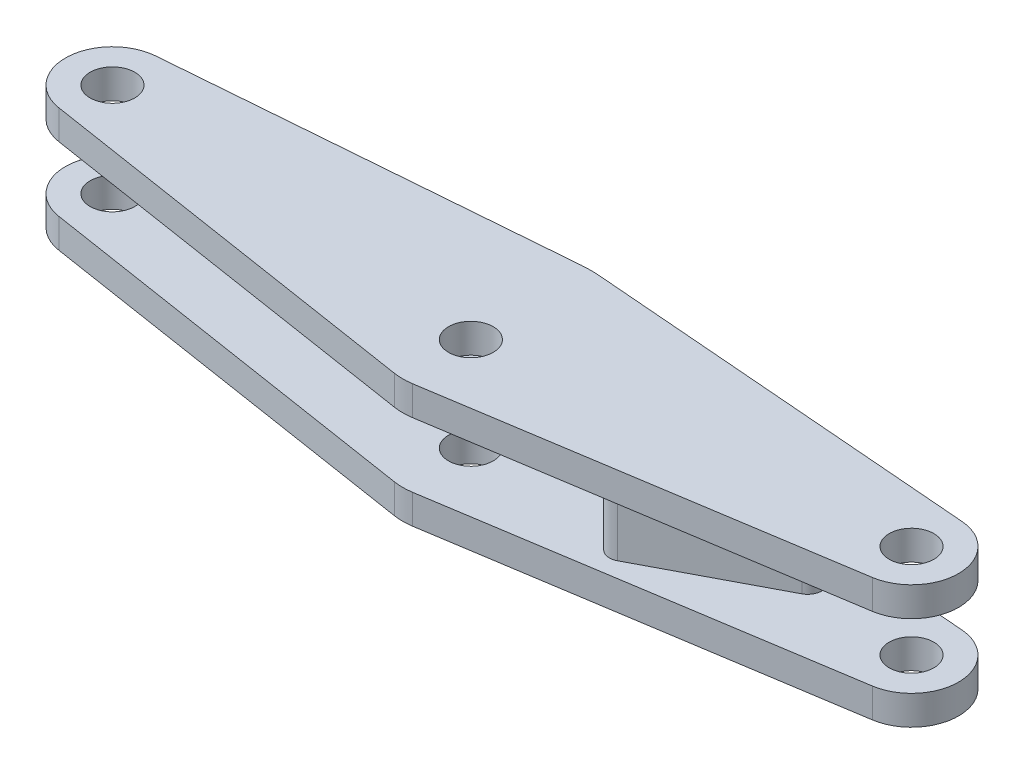
from build123d import *

# Parameters (mm, degrees)
SKETCH1_R                = 0.95
BOSS_EXTRUDE1_DEPTH      = 2.625
CUT_EXTRUDE1_DEPTH       = 20.736086872
CUT_EXTRUDE1_DEPTH_BACK  = 20.736086872
SKETCH3_W                = 38
SKETCH3_H                = 2.75
BOSS_EXTRUDE2_DEPTH      = 2.625
BOSS_EXTRUDE2_DEPTH_BACK = 1.375


with BuildPart() as part:
    # Sketch1 → Boss-Extrude1 (new, symmetric)
    with BuildSketch(Plane(origin=(0, 0, 0), x_dir=(1, 0, 0), z_dir=(0, 1, 0))):
        with BuildLine():
            Line((-17.159441359, 1.993634483), (-0.398603397, 3.334086208))
            ThreePointArc((-0.398603397, 3.334086208), (0, 3.35), (0.398603397, 3.334086208))
            Line((0.398603397, 3.334086208), (17.159441359, 1.993634483))
            ThreePointArc((17.159441359, 1.993634483), (18.998587128, 0.0751631), (17.308732868, -1.976027332))
            Line((17.308732868, -1.976027332), (0.385916086, -4.620034165))
            ThreePointArc((0.385916086, -4.620034165), (0, -4.65), (-0.385916086, -4.620034165))
            Line((-0.385916086, -4.620034165), (-17.308732868, -1.976027332))
            ThreePointArc((-17.308732868, -1.976027332), (-18.998587128, 0.0751631), (-17.159441359, 1.993634483))
        make_face()
        with Locations(Location((-17, 0, 0), (0, 0, 90))):
            Circle(SKETCH1_R, mode=Mode.SUBTRACT)
        with Locations(Location((17, 0, 0), (0, 0, 90))):
            Circle(SKETCH1_R, mode=Mode.SUBTRACT)
        with Locations(Location((0, -1.75, 0), (0, 0, 90))):
            Circle(SKETCH1_R, mode=Mode.SUBTRACT)
    extrude(amount=BOSS_EXTRUDE1_DEPTH, both=True)

    # Sketch3 → Cut-Extrude1 (cut, two sides: drawn at the far end of the back side and taken through both)
    with BuildSketch(Plane.XY.offset(-CUT_EXTRUDE1_DEPTH_BACK)):
        Rectangle(SKETCH3_W, SKETCH3_H)
    extrude(amount=CUT_EXTRUDE1_DEPTH + CUT_EXTRUDE1_DEPTH_BACK, mode=Mode.SUBTRACT)


with BuildPart() as cut_extrude1_piece_1:
    # of the separate pieces the step leaves, piece 1, a body of its own (cut_extrude1_pieces)
    add(part.part.solids().sort_by_distance((-17.159441359, -2.625, -1.993634483))[0])



with BuildPart() as cut_extrude1_piece_2:
    # of the separate pieces the step leaves, piece 2, a body of its own (cut_extrude1_pieces)
    add(part.part.solids().sort_by_distance((-17.159441359, 1.375, -1.993634483))[0])


with BuildPart() as cut_extrude1_piece_1_1:
    add(cut_extrude1_piece_1.part)

    add(cut_extrude1_piece_2.part)  # Boss-Extrude2 merges Cut-Extrude1 piece 2
    # Sketch4 → Boss-Extrude2 (add, two sides: drawn at the far end of the back side and taken through both)
    with BuildSketch(Plane(origin=(0, 0, 0), x_dir=(1, 0, 0), z_dir=(0, 1, 0)).offset(-BOSS_EXTRUDE2_DEPTH_BACK)):
        with BuildLine():
            Line((6.720689655, -1.718976713), (11.853914762, 0.981023287))
            ThreePointArc((11.853914762, 0.981023287), (12.664248394, 0.729310345), (12.412535452, -0.081023287))
            Line((12.412535452, -0.081023287), (7.279310345, -2.781023287))
            ThreePointArc((7.279310345, -2.781023287), (6.468976713, -2.529310345), (6.720689655, -1.718976713))
        make_face()
    extrude(amount=BOSS_EXTRUDE2_DEPTH + BOSS_EXTRUDE2_DEPTH_BACK)


solid = cut_extrude1_piece_1_1.part
